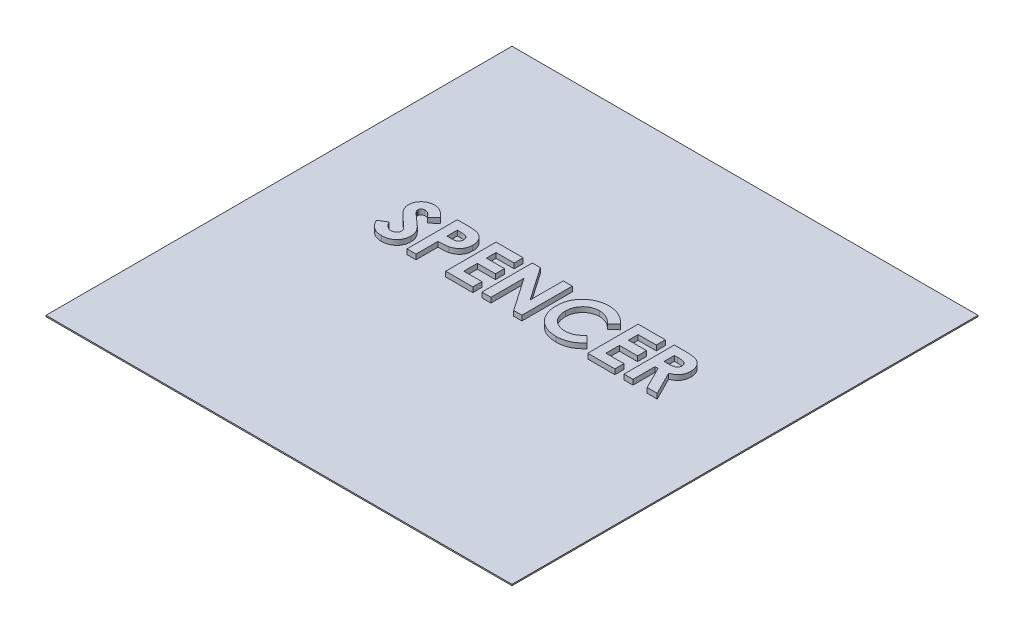
from build123d import *

# Parameters (mm, degrees)
SKETCH1_W           = 1850
SKETCH1_H           = 1850
BOSS_EXTRUDE1_DEPTH = 5
BOSS_EXTRUDE2_DEPTH = 20


with BuildPart() as part:
    # Sketch1 → Boss-Extrude1 (new body)
    with BuildSketch(Plane(origin=(0, 0, 0), x_dir=(1, 0, 0), z_dir=(0, 1, 0))):
        Rectangle(SKETCH1_W, SKETCH1_H)
    extrude(amount=BOSS_EXTRUDE1_DEPTH)

    # Sketch2 → Boss-Extrude2 (add)
    # profile 1 of 7: a face of its own
    with BuildSketch(Plane(origin=(0, 5, 0), x_dir=(1, 0, 0), z_dir=(0, 1, 0))):
        with BuildLine():
            Line((-458.08120012, 173.27724359), (-484.924148838, 148.717948718))
            add(Edge.make_bspline(
                [(-484.924148838, 148.717948718), (-486.073985661, 150.339913095), (-488.281512012, 153.453858509), (-491.859681973, 157.623504813), (-495.421694663, 161.180523411), (-499.000549963, 164.110054723), (-502.627969484, 166.394299668), (-506.297656556, 168.011570322), (-509.988806697, 169.039684625), (-512.468689809, 169.167709592), (-513.690174479, 169.230769231)],
                knots=[0, 0, 0, 0, 1.299362458, 2.494594718, 3.587462134, 4.587049575, 5.512617175, 6.380583204, 7.202344345, 8, 8, 8, 8], degree=3))
            add(Edge.make_bspline(
                [(-513.690174479, 169.230769231), (-514.829540341, 169.190811751), (-517.029356474, 169.113664355), (-520.165357571, 168.346824988), (-522.949544007, 167.023372855), (-525.379198537, 165.292847852), (-527.303843392, 163.207966424), (-528.840523056, 161.021461874), (-529.705802833, 158.608055341), (-529.819690676, 156.950430379), (-529.876071915, 156.129807692)],
                knots=[0, 0, 0, 0, 1.185010067, 2.2879431, 3.333075148, 4.379039566, 5.372662701, 6.27520591, 7.14612461, 8, 8, 8, 8], degree=3))
            add(Edge.make_bspline(
                [(-529.876071915, 156.129807692), (-529.840740651, 155.297351261), (-529.769588395, 153.620899694), (-529.08235446, 151.163851138), (-528.04649669, 148.763028677), (-527.0566923, 147.301533804), (-526.550751402, 146.554487179)],
                knots=[0, 0, 0, 0, 0.967525499, 1.948461899, 2.951351359, 4, 4, 4, 4], degree=3))
            add(Edge.make_bspline(
                [(-526.550751402, 146.554487179), (-526.090796395, 145.973815655), (-525.032040715, 144.637186494), (-523.013210479, 142.520174257), (-520.47798369, 139.926648962), (-517.328799488, 136.945794342), (-513.696389165, 133.470407209), (-509.412385814, 129.637106354), (-504.600101734, 125.327178903), (-501.179641701, 122.325901497), (-499.387289863, 120.753205128)],
                knots=[0, 0, 0, 0, 0.473873513, 1.090794244, 1.870441696, 2.795289791, 3.865433203, 5.087734844, 6.473946851, 8, 8, 8, 8], degree=3))
            add(Edge.make_bspline(
                [(-499.387289863, 120.753205128), (-497.704909837, 119.297190075), (-494.512102072, 116.533976002), (-489.969370658, 112.612037286), (-485.977066328, 109.083564652), (-482.477030321, 106.001512926), (-479.522319767, 103.333544327), (-477.100513054, 101.066905997), (-475.182031918, 99.245725216), (-474.091487722, 98.145730916), (-473.626071915, 97.676282051)],
                knots=[0, 0, 0, 0, 1.543621617, 2.929473131, 4.163658386, 5.240097082, 6.164993805, 6.925417477, 7.541396219, 8, 8, 8, 8], degree=3))
            add(Edge.make_bspline(
                [(-473.626071915, 97.676282051), (-471.860381373, 95.76542673), (-468.466104069, 92.09209174), (-464.054740136, 86.399577746), (-460.424044925, 80.84252336), (-457.615270261, 75.316363591), (-455.493970665, 69.741366951), (-453.998426349, 63.98080695), (-453.102734907, 57.974489348), (-453.003292245, 53.875910813), (-452.952994991, 51.802884615)],
                knots=[0, 0, 0, 0, 1.206664779, 2.319633467, 3.337109185, 4.282041471, 5.190008762, 6.099243693, 7.03861361, 8, 8, 8, 8], degree=3))
            add(Edge.make_bspline(
                [(-452.952994991, 51.802884615), (-452.988795289, 49.78297482), (-453.059036805, 45.819836622), (-453.919360671, 40.020374202), (-455.146132009, 34.470036966), (-457.04293571, 29.22922043), (-459.354748828, 24.211898188), (-462.252940463, 19.496224166), (-465.656469138, 15.034473817), (-469.557435586, 10.906406384), (-473.872367697, 7.160471314), (-478.500542469, 3.825751438), (-483.487216525, 1.072515416), (-488.789784509, -1.194578063), (-494.405408075, -2.940723774), (-500.327397323, -4.231288194), (-506.56481034, -5.005864615), (-510.830043243, -5.08683739), (-513.009084735, -5.128205128)],
                knots=[0, 0, 0, 0, 1.043214005, 2.046824704, 3.02475056, 3.976699089, 4.921714032, 5.875962561, 6.831408892, 7.817874052, 8.806269674, 9.781291748, 10.760897367, 11.74438705, 12.757449933, 13.795994037, 14.874007457, 16, 16, 16, 16], degree=3))
            add(Edge.make_bspline(
                [(-513.009084735, -5.128205128), (-514.71961375, -5.097859204), (-518.10744219, -5.037756871), (-523.100589131, -4.547071344), (-527.922036947, -3.755157112), (-532.566354707, -2.620107453), (-537.054465883, -1.181845589), (-541.386554795, 0.57493618), (-545.532715597, 2.677467314), (-549.524320104, 5.082511415), (-553.341964195, 7.875084416), (-557.033920477, 10.998093079), (-560.563516935, 14.499570673), (-563.947705504, 18.371236338), (-567.164833203, 22.624053702), (-570.320208166, 27.198794414), (-573.273596034, 32.180359449), (-575.098035095, 35.674967619), (-576.029918068, 37.459935897)],
                knots=[0, 0, 0, 0, 1.016823716, 2.013894106, 2.979844003, 3.91962641, 4.853723003, 5.779685073, 6.695824784, 7.614987388, 8.547259901, 9.504950863, 10.487499108, 11.500346958, 12.559593716, 13.656357062, 14.802919212, 16, 16, 16, 16], degree=3))
            Line((-576.029918068, 37.459935897), (-544.459405248, 56.41025641))
            add(Edge.make_bspline(
                [(-544.459405248, 56.41025641), (-543.293758926, 54.384084193), (-541.059115304, 50.499738885), (-537.272302776, 45.280628655), (-533.392906664, 40.811324663), (-529.331238805, 37.170822146), (-525.136687561, 34.310442904), (-520.788992274, 32.266217457), (-516.285098338, 31.000844219), (-513.217250398, 30.84631292), (-511.68696935, 30.769230769)],
                knots=[0, 0, 0, 0, 1.283663364, 2.460892379, 3.537111102, 4.529833553, 5.449777664, 6.316464042, 7.160231139, 8, 8, 8, 8], degree=3))
            add(Edge.make_bspline(
                [(-511.68696935, 30.769230769), (-510.130454439, 30.832180233), (-507.110588819, 30.954311361), (-502.800117082, 32.082399769), (-498.848113382, 33.853581326), (-495.432030572, 36.380813167), (-492.539507031, 39.297622822), (-490.404658627, 42.542706932), (-489.06353246, 46.053809605), (-488.921742909, 48.492852478), (-488.850430889, 49.719551282)],
                knots=[0, 0, 0, 0, 1.13588714, 2.203786484, 3.234766741, 4.283437687, 5.291419208, 6.222934724, 7.106237994, 8, 8, 8, 8], degree=3))
            add(Edge.make_bspline(
                [(-488.850430889, 49.719551282), (-488.91628462, 50.860794899), (-489.05006017, 53.179122052), (-490.035409647, 56.626101737), (-491.575811424, 60.071513806), (-493.398215352, 62.897534), (-495.252739544, 65.263684101), (-497.02608296, 67.31384613), (-499.185546136, 69.578916254), (-501.725653624, 72.061743761), (-504.612843977, 74.784185609), (-507.849549278, 77.745975205), (-511.472833229, 80.921022727), (-514.033777474, 83.083833729), (-515.372866786, 84.21474359)],
                knots=[0, 0, 0, 0, 0.916159276, 1.861089862, 2.860218735, 3.940849679, 4.552606315, 5.27541173, 6.11797699, 7.06649574, 8.129236253, 9.306560635, 10.591630461, 12, 12, 12, 12], degree=3))
            add(Edge.make_bspline(
                [(-515.372866786, 84.21474359), (-517.918528866, 86.368617819), (-522.804424913, 90.502554393), (-529.708815909, 96.608248576), (-535.930290407, 102.314579249), (-541.415113073, 107.692089134), (-546.233169031, 112.641468086), (-550.351828313, 117.202916853), (-553.725845574, 121.411620774), (-557.276271212, 126.396548928), (-560.649885428, 132.471026406), (-563.565645462, 139.779327002), (-565.457267506, 147.086700283), (-565.669197447, 151.99246822), (-565.773507812, 154.407051282)],
                knots=[0, 0, 0, 0, 1.345494975, 2.582412109, 3.71882943, 4.751509156, 5.681369928, 6.505683931, 7.230279997, 7.856715994, 8.973648664, 10.023341002, 11.027102913, 12, 12, 12, 12], degree=3))
            add(Edge.make_bspline(
                [(-565.773507812, 154.407051282), (-565.73012527, 156.119343989), (-565.644657002, 159.492744556), (-564.882266869, 164.452838569), (-563.74284577, 169.238912529), (-562.088079216, 173.833504656), (-559.940392033, 178.230860039), (-557.332109373, 182.452505583), (-554.222729549, 186.459586217), (-550.718668401, 190.249445528), (-546.858090154, 193.712945655), (-542.732571689, 196.76983156), (-538.365463805, 199.351721845), (-533.783482255, 201.493587314), (-528.958234408, 203.133049268), (-523.925267642, 204.295181619), (-518.677363087, 204.986380881), (-515.107851687, 205.0803414), (-513.289533453, 205.128205128)],
                knots=[0, 0, 0, 0, 1.010766082, 1.991317756, 2.957454644, 3.913069143, 4.869106762, 5.843196583, 6.838735724, 7.860187025, 8.887984031, 9.89767229, 10.887916223, 11.879572884, 12.879850636, 13.892031539, 14.926195476, 16, 16, 16, 16], degree=3))
            add(Edge.make_bspline(
                [(-513.289533453, 205.128205128), (-510.933083018, 205.042001151), (-506.238783142, 204.87027366), (-499.298125384, 203.527420797), (-492.518781071, 201.415643221), (-487.055858372, 198.868015912), (-482.709112752, 196.400128132), (-479.377738276, 194.128007938), (-475.987885431, 191.525172136), (-472.512217156, 188.583418506), (-469.01531675, 185.247320544), (-465.397750611, 181.59629669), (-461.7088125, 177.598793558), (-459.311587622, 174.742995857), (-458.08120012, 173.27724359)],
                knots=[0, 0, 0, 0, 1.282922637, 2.555718331, 3.837320111, 5.142675274, 5.830281639, 6.55870424, 7.337177975, 8.157850921, 9.037902056, 9.96903443, 10.957596896, 12, 12, 12, 12], degree=3))
        make_face()
    # profile 2 of 7: a face of its own
    with BuildSketch(Plane(origin=(0, 5, 0), x_dir=(1, 0, 0), z_dir=(0, 1, 0))):
        with BuildLine():
            Line((-417.055559094, 200), (-376.99145653, 200))
            add(Edge.make_bspline(
                [(-376.99145653, 200), (-374.373720043, 199.988282454), (-369.323557648, 199.965676853), (-362.040807979, 199.691553861), (-355.322114828, 199.200308763), (-349.169021801, 198.59320751), (-343.5840589, 197.742075175), (-338.560232073, 196.766318594), (-334.096498758, 195.577563089), (-330.142523726, 194.166526781), (-326.593958853, 192.502970103), (-323.235871964, 190.731163494), (-320.144156196, 188.616574798), (-317.162763313, 186.387105402), (-314.462144688, 183.829774952), (-311.873819564, 181.114777501), (-309.507410569, 178.134438483), (-307.351952643, 174.924834098), (-305.396620174, 171.545264113), (-303.688310921, 167.989686858), (-302.302626121, 164.252476004), (-301.140208876, 160.357807057), (-300.206544021, 156.305849754), (-299.585066971, 152.071684198), (-299.162928494, 147.684874942), (-299.125680602, 144.699209795), (-299.106841145, 143.189102564)],
                knots=[0, 0, 0, 0, 1.698747864, 3.27724071, 4.728299578, 6.070144658, 7.288476769, 8.393259625, 9.389771311, 10.283485332, 11.113357557, 11.931608583, 12.74405601, 13.541433047, 14.344816069, 15.154114104, 15.974336324, 16.810834471, 17.661136416, 18.50621059, 19.367396281, 20.244825668, 21.142564693, 22.063065223, 23.020325768, 24, 24, 24, 24], degree=3))
            add(Edge.make_bspline(
                [(-299.106841145, 143.189102564), (-299.134099481, 141.518506891), (-299.18766546, 138.235581102), (-299.712784678, 133.423214664), (-300.609854212, 128.835058971), (-301.782277171, 124.432421284), (-303.417137608, 120.287734752), (-305.284888887, 116.302105883), (-307.582815392, 112.587279476), (-310.208563783, 109.096787528), (-313.076180583, 105.80225069), (-316.253742893, 102.798792484), (-319.680685007, 100.065938439), (-323.337169585, 97.575048032), (-327.236924169, 95.331145942), (-331.377134893, 93.313220411), (-335.786073462, 91.585810955), (-338.85632563, 90.682389797), (-340.412930889, 90.224358974)],
                knots=[0, 0, 0, 0, 1.102006807, 2.165578795, 3.188629044, 4.184801286, 5.166646146, 6.124351954, 7.085497154, 8.042432466, 9.003981491, 9.963833307, 10.922997304, 11.89326795, 12.880200226, 13.889073926, 14.929769137, 16, 16, 16, 16], degree=3))
            add(Edge.make_bspline(
                [(-340.412930889, 90.224358974), (-341.438200655, 89.969270197), (-343.659265125, 89.416665762), (-347.334516775, 88.855633561), (-351.569858419, 88.339798949), (-356.378985686, 87.896501546), (-361.764671153, 87.595162606), (-367.721700068, 87.359830296), (-374.252772063, 87.188719403), (-378.794221263, 87.182647637), (-381.158123197, 87.179487179)],
                knots=[0, 0, 0, 0, 0.618981996, 1.340914327, 2.176866532, 3.120127938, 4.170906482, 5.338178032, 6.614476169, 8, 8, 8, 8], degree=3))
            Line((-381.158123197, 87.179487179), (-381.158123197, 0))
            Line((-381.158123197, 0), (-417.055559094, 0))
            Line((-417.055559094, 0), (-417.055559094, 200))
        make_face()
        with BuildLine():
            Line((-381.158123197, 123.076923077), (-368.457802684, 123.076923077))
            add(Edge.make_bspline(
                [(-368.457802684, 123.076923077), (-366.146778857, 123.091576762), (-361.894460684, 123.118539759), (-356.08729569, 123.50844038), (-351.420546197, 124.103897383), (-347.733727437, 124.957920433), (-344.822634822, 126.254013499), (-342.311999697, 127.753349106), (-340.158563854, 129.649217824), (-338.294005368, 131.815572225), (-336.80334705, 134.304822012), (-335.769653148, 137.076434584), (-335.098185913, 140.072175392), (-335.036169677, 142.157012712), (-335.004277043, 143.229166667)],
                knots=[0, 0, 0, 0, 1.8619151, 3.425951444, 4.686033666, 5.651700536, 6.461346321, 7.243864085, 7.999046032, 8.762387399, 9.539336099, 10.322741239, 11.137448474, 12, 12, 12, 12], degree=3))
            add(Edge.make_bspline(
                [(-335.004277043, 143.229166667), (-335.035841617, 144.165893613), (-335.097084479, 145.983369111), (-335.546991225, 148.606437059), (-336.264013158, 151.051677501), (-337.302950375, 153.293553138), (-338.646050189, 155.328254665), (-340.28356066, 157.154980543), (-342.194469313, 158.81285165), (-343.669802517, 159.69038815), (-344.419341145, 160.136217949)],
                knots=[0, 0, 0, 0, 1.102301479, 2.1387299, 3.123554645, 4.094223062, 5.036071848, 5.982632524, 6.975082478, 8, 8, 8, 8], degree=3))
            add(Edge.make_bspline(
                [(-344.419341145, 160.136217949), (-345.05424363, 160.457306341), (-346.398462296, 161.137116267), (-348.68779701, 161.92744501), (-351.329654309, 162.594174367), (-354.34186971, 163.147553297), (-357.712426618, 163.577032816), (-361.440723672, 163.905477208), (-365.53224741, 164.037557491), (-368.377657355, 164.080297569), (-369.860046274, 164.102564103)],
                knots=[0, 0, 0, 0, 0.656809284, 1.390599849, 2.23162475, 3.173112763, 4.218524733, 5.370385145, 6.63003504, 8, 8, 8, 8], degree=3))
            Line((-369.860046274, 164.102564103), (-381.158123197, 164.102564103))
            Line((-381.158123197, 164.102564103), (-381.158123197, 123.076923077))
        make_face(mode=Mode.SUBTRACT)
    # profile 3 of 7: a face of its own
    with BuildSketch(Plane(origin=(0, 5, 0), x_dir=(1, 0, 0), z_dir=(0, 1, 0))):
        Polygon((-263.209405248, 200), (-155.517097556, 200), (-155.517097556, 164.102564103), (-227.31196935, 164.102564103), (-227.31196935, 125.641025641), (-155.517097556, 125.641025641), (-155.517097556, 89.743589744), (-227.31196935, 89.743589744), (-227.31196935, 35.897435897), (-155.517097556, 35.897435897), (-155.517097556, 0), (-263.209405248, 0), align=None)
    # profile 4 of 7: a face of its own
    with BuildSketch(Plane(origin=(0, 5, 0), x_dir=(1, 0, 0), z_dir=(0, 1, 0))):
        Polygon((-119.619661658, 200), (-87.287930889, 200), (3.457261419, 68.389423077), (3.457261419, 200), (39.354697316, 200), (39.354697316, 0), (6.782581932, 0), (-83.722225761, 131.209935897), (-83.722225761, 0), (-119.619661658, 0), align=None)
    # profile 5 of 7: a face of its own
    with BuildSketch(Plane(origin=(0, 5, 0), x_dir=(1, 0, 0), z_dir=(0, 1, 0))):
        with BuildLine():
            Line((264.995722957, 165.304487179), (238.673607573, 140.144230769))
            add(Edge.make_bspline(
                [(238.673607573, 140.144230769), (236.440751304, 142.453007893), (232.079283482, 146.962772931), (225.051317484, 152.933304411), (217.742488737, 157.908934556), (210.294975916, 162.099378586), (202.574819855, 165.269748147), (194.67128658, 167.580049848), (186.533909707, 168.988553473), (181.026846027, 169.149711215), (178.256940906, 169.230769231)],
                knots=[0, 0, 0, 0, 1.115251505, 2.178435587, 3.19620269, 4.182487026, 5.141301733, 6.088180966, 7.038406374, 8, 8, 8, 8], degree=3))
            add(Edge.make_bspline(
                [(178.256940906, 169.230769231), (175.943733522, 169.166730565), (171.378873612, 169.040357313), (164.676463043, 168.113916732), (158.265260946, 166.538464207), (152.123320761, 164.367198793), (146.26871541, 161.557696588), (140.689169986, 158.112132074), (135.398440626, 154.061623599), (130.4664148, 149.427128679), (125.954770904, 144.363594712), (121.96844625, 138.960816048), (118.629259908, 133.231170151), (115.888843992, 127.232682663), (113.754165929, 120.937589616), (112.229737595, 114.350129115), (111.348048986, 107.462456003), (111.216451052, 102.780267144), (111.149569111, 100.400641026)],
                knots=[0, 0, 0, 0, 1.035432265, 2.043311493, 3.022114605, 3.98653278, 4.95457646, 5.923598177, 6.917315552, 7.932509744, 8.948865224, 9.949768934, 10.933144597, 11.912367597, 12.897413939, 13.903909035, 14.934704909, 16, 16, 16, 16], degree=3))
            add(Edge.make_bspline(
                [(111.149569111, 100.400641026), (111.168843724, 98.730452919), (111.206834381, 95.438477845), (111.622709314, 90.568733056), (112.292366018, 85.843929348), (113.261525181, 81.271223541), (114.473468241, 76.846652885), (115.895353409, 72.532046837), (117.679087435, 68.387023535), (119.659059118, 64.363441226), (121.961743368, 60.571088388), (124.444461779, 56.95476522), (127.13656455, 53.532198578), (130.055488589, 50.317380017), (133.242314121, 47.360549954), (136.614673497, 44.572792989), (140.229453752, 42.023896121), (144.011566741, 39.649891979), (147.99368514, 37.587574382), (152.067764843, 35.719513066), (156.295577111, 34.202369536), (160.62564579, 32.979413444), (165.042496741, 31.939471935), (169.589330868, 31.299147988), (174.226732813, 30.814238157), (177.360838143, 30.78429781), (178.93803065, 30.769230769)],
                knots=[0, 0, 0, 0, 1.103660481, 2.175337485, 3.227646561, 4.255952547, 5.262355991, 6.258840057, 7.255597736, 8.242457506, 9.22035537, 10.185017736, 11.140346927, 12.096287581, 13.051739095, 14.01125915, 14.986044842, 15.97314143, 16.960198552, 17.947847494, 18.933482797, 19.925264591, 20.920966487, 21.929612487, 22.958107872, 24, 24, 24, 24], degree=3))
            add(Edge.make_bspline(
                [(178.93803065, 30.769230769), (181.613220189, 30.846611447), (186.869271979, 30.998644357), (194.583283734, 32.187520187), (201.933968433, 34.143153648), (207.807130332, 36.452643133), (212.408597547, 38.733293981), (215.911626515, 40.842783705), (219.534031492, 43.202479571), (223.21564743, 45.901439056), (226.997885206, 48.907273563), (230.813979601, 52.285816477), (234.761623309, 55.925817227), (237.347685571, 58.523757271), (238.673607573, 59.855769231)],
                knots=[0, 0, 0, 0, 1.404581149, 2.759636711, 4.088442092, 5.392261763, 6.066678138, 6.783632037, 7.538459478, 8.336747902, 9.180226004, 10.074962426, 11.012997595, 12, 12, 12, 12], degree=3))
            Line((238.673607573, 59.855769231), (264.194440906, 33.052884615))
            add(Edge.make_bspline(
                [(264.194440906, 33.052884615), (262.40046369, 31.320855935), (258.89900382, 27.940306356), (253.617148809, 23.140241408), (248.341941223, 18.82684945), (243.200819085, 14.843573258), (238.109565454, 11.306455342), (233.068720248, 8.211963141), (228.13534804, 5.481832471), (223.207005773, 3.162105646), (218.25302676, 1.192416645), (213.155964527, -0.503356301), (207.900236875, -1.937919208), (202.453744219, -3.09542307), (196.867288122, -4.023584904), (191.088586779, -4.650088774), (185.15428001, -5.071266481), (181.128947791, -5.109112789), (179.09828706, -5.128205128)],
                knots=[0, 0, 0, 0, 1.244526981, 2.429050516, 3.560637417, 4.644440555, 5.67424972, 6.652764056, 7.595344123, 8.486817594, 9.369275933, 10.254498637, 11.166417451, 12.086725134, 13.032340136, 13.991389299, 14.986715468, 16, 16, 16, 16], degree=3))
            add(Edge.make_bspline(
                [(179.09828706, -5.128205128), (175.368214834, -5.033118148), (168.069500326, -4.84705936), (157.373424517, -3.46848971), (147.212439617, -1.157341978), (137.561825853, 2.111258382), (128.424651894, 6.286742155), (119.803255309, 11.405689196), (111.711531872, 17.45449927), (104.214846781, 24.362274451), (97.433738335, 31.991332234), (91.44002376, 40.182847335), (86.482022837, 48.977078049), (82.365287838, 58.244105497), (79.146055211, 68.026218723), (76.880261191, 78.333998995), (75.482962555, 89.157493514), (75.330096098, 96.550189771), (75.252133214, 100.320512821)],
                knots=[0, 0, 0, 0, 1.078019885, 2.10938526, 3.111377082, 4.085535484, 5.04941344, 6.010039228, 6.978205633, 7.964457913, 8.951525778, 9.924444315, 10.892603023, 11.863865945, 12.85144698, 13.863884204, 14.910567087, 16, 16, 16, 16], degree=3))
            add(Edge.make_bspline(
                [(75.252133214, 100.320512821), (75.28507655, 102.779485345), (75.350362191, 107.652567897), (76.036520327, 114.8310133), (76.993064666, 121.828713539), (78.51053528, 128.5730093), (80.33969644, 135.154758683), (82.614498667, 141.502425761), (85.331308787, 147.634254366), (88.402557613, 153.56050955), (91.877030682, 159.24236799), (95.758398526, 164.631013568), (99.946739601, 169.768045636), (104.54269292, 174.585311927), (109.479473261, 179.125108976), (114.779369619, 183.362834753), (120.410505766, 187.359263026), (126.388123094, 191.01133561), (132.596092426, 194.314829377), (138.956114932, 197.228651969), (145.452564773, 199.663936651), (152.057974373, 201.683915463), (158.800251501, 203.191686816), (165.631271499, 204.33302109), (172.609158145, 204.971034246), (177.294204516, 205.075481071), (179.659184496, 205.128205128)],
                knots=[0, 0, 0, 0, 1.071919942, 2.124283339, 3.142214191, 4.149696895, 5.136002878, 6.119640489, 7.086990633, 8.058538607, 9.028339693, 9.988281803, 10.952401235, 11.916291999, 12.888973767, 13.874849856, 14.873389453, 15.898127285, 16.927174885, 17.938320013, 18.946391617, 19.950418109, 20.947802303, 21.956882652, 22.968648068, 24, 24, 24, 24], degree=3))
            add(Edge.make_bspline(
                [(179.659184496, 205.128205128), (181.676754909, 205.097982383), (185.69091862, 205.037851126), (191.66868199, 204.53659167), (197.598638007, 203.749368764), (203.459555609, 202.561617046), (209.293358071, 201.15160566), (215.02338269, 199.305390245), (220.740023703, 197.247435243), (226.353624086, 194.787570248), (231.872019603, 192.10240541), (237.165933145, 189.055988387), (242.324249033, 185.835792281), (247.232662083, 182.251231776), (251.983117441, 178.432325548), (256.55077456, 174.361256255), (260.895549579, 169.970147219), (263.622089139, 166.867569475), (264.995722957, 165.304487179)],
                knots=[0, 0, 0, 0, 0.996412454, 1.982464992, 2.961075852, 3.949442424, 4.934965278, 5.923860011, 6.921385422, 7.934793307, 8.949617135, 9.951082467, 10.950285876, 11.951772932, 12.951063433, 13.960125323, 14.972308753, 16, 16, 16, 16], degree=3))
        make_face()
    # profile 6 of 7: a face of its own
    with BuildSketch(Plane(origin=(0, 5, 0), x_dir=(1, 0, 0), z_dir=(0, 1, 0))):
        Polygon((300.893158855, 200), (408.585466547, 200), (408.585466547, 164.102564103), (336.790594752, 164.102564103), (336.790594752, 125.641025641), (408.585466547, 125.641025641), (408.585466547, 89.743589744), (336.790594752, 89.743589744), (336.790594752, 35.897435897), (408.585466547, 35.897435897), (408.585466547, 0), (300.893158855, 0), align=None)
    # profile 7 of 7: a face of its own
    with BuildSketch(Plane(origin=(0, 5, 0), x_dir=(1, 0, 0), z_dir=(0, 1, 0))):
        with BuildLine():
            Line((444.482902444, 200), (486.309825521, 200))
            add(Edge.make_bspline(
                [(486.309825521, 200), (489.074572405, 199.990186735), (494.39195945, 199.971313063), (502.059341138, 199.673536508), (509.102885655, 199.259155992), (515.533021606, 198.626800325), (521.346998074, 197.788373148), (526.550642021, 196.800006248), (531.14380135, 195.673550265), (535.165213017, 194.269897236), (538.794338191, 192.6865979), (542.177187399, 190.867357931), (545.388391324, 188.83243514), (548.406486536, 186.528285202), (551.257700992, 183.996359205), (553.947413679, 181.234108519), (556.437616464, 178.218110394), (558.71288991, 174.967422111), (560.786618509, 171.547772581), (562.619359654, 167.954466602), (564.1097478, 164.185005268), (565.426665493, 160.293865446), (566.375198643, 156.225422529), (567.034889574, 152.019283495), (567.517889466, 147.660642287), (567.54565965, 144.699574973), (567.559825521, 143.189102564)],
                knots=[0, 0, 0, 0, 1.749336639, 3.364467119, 4.854658419, 6.213483162, 7.451590619, 8.570285859, 9.5643256, 10.440900261, 11.26203566, 12.067320669, 12.869050712, 13.665104639, 14.467235401, 15.27997916, 16.102287765, 16.939272006, 17.78853747, 18.631303466, 19.488103222, 20.351255419, 21.228522269, 22.127379805, 23.044756219, 24, 24, 24, 24], degree=3))
            add(Edge.make_bspline(
                [(567.559825521, 143.189102564), (567.523027683, 141.612516359), (567.450873828, 138.521118158), (567.062213911, 133.980106333), (566.351865674, 129.635583849), (565.275939927, 125.500270933), (564.039303031, 121.522698796), (562.394893175, 117.776256129), (560.539014125, 114.206456353), (558.3348408, 110.863795638), (555.915868257, 107.674026811), (553.102654073, 104.759361749), (550.077451317, 101.963148242), (546.670202323, 99.460531617), (543.031101792, 97.082293981), (539.087844625, 94.926977334), (534.866165871, 92.940401978), (531.898116637, 91.832550333), (530.380338342, 91.266025641)],
                knots=[0, 0, 0, 0, 1.099860209, 2.156625411, 3.176576793, 4.16617041, 5.135385252, 6.078461593, 7.016046972, 7.938469504, 8.868247731, 9.803980173, 10.76021508, 11.73834243, 12.748633912, 13.790971185, 14.870363756, 16, 16, 16, 16], degree=3))
            Line((530.380338342, 91.266025641), (576.534184496, 0))
            Line((576.534184496, 0), (536.630338342, 0))
            Line((536.630338342, 0), (492.559825521, 87.179487179))
            Line((492.559825521, 87.179487179), (480.380338342, 87.179487179))
            Line((480.380338342, 87.179487179), (480.380338342, 0))
            Line((480.380338342, 0), (444.482902444, 0))
            Line((444.482902444, 0), (444.482902444, 200))
        make_face()
        with BuildLine():
            Line((480.380338342, 123.076923077), (494.362710137, 123.076923077))
            add(Edge.make_bspline(
                [(494.362710137, 123.076923077), (496.072171317, 123.096176178), (499.34542216, 123.133041729), (504.052786786, 123.304039435), (508.328196512, 123.716059411), (512.190011392, 124.236631253), (515.657663727, 124.837706621), (518.700223281, 125.699084119), (521.364571254, 126.622071912), (523.619135021, 127.769106314), (525.5453825, 129.073533211), (527.208573909, 130.555394592), (528.584271677, 132.270460452), (529.716541111, 134.172122698), (530.597323628, 136.277201065), (531.24022739, 138.562586563), (531.599515521, 141.054312672), (531.640852844, 142.773942968), (531.662389624, 143.669871795)],
                knots=[0, 0, 0, 0, 1.688639943, 3.233382647, 4.650958383, 5.928841754, 7.082724185, 8.122798841, 9.049171256, 9.863274652, 10.613301712, 11.341792392, 12.054588806, 12.776240173, 13.521029143, 14.301969904, 15.115324896, 16, 16, 16, 16], degree=3))
            add(Edge.make_bspline(
                [(531.662389624, 143.669871795), (531.621672368, 144.729821003), (531.541690864, 146.811894801), (530.748025867, 149.809351007), (529.484682627, 152.583701806), (527.752985069, 155.122411995), (525.572137129, 157.348020599), (523.069442054, 159.309912308), (520.190885645, 160.861229475), (517.525559024, 161.88446176), (515.100734797, 162.496672192), (512.912407434, 162.952885992), (510.378311172, 163.276217806), (507.496532908, 163.619168749), (504.274418391, 163.841555076), (500.694405171, 164.003852768), (496.76677502, 164.070256726), (494.028843773, 164.091484902), (492.599889624, 164.102564103)],
                knots=[0, 0, 0, 0, 1.020303359, 2.004196876, 2.966617323, 3.9489082, 4.950758222, 5.960522915, 7.003732012, 8.091992268, 8.70421221, 9.413913587, 10.24622431, 11.166358409, 12.212345909, 13.359657661, 14.621978493, 16, 16, 16, 16], degree=3))
            Line((492.599889624, 164.102564103), (480.380338342, 164.102564103))
            Line((480.380338342, 164.102564103), (480.380338342, 123.076923077))
        make_face(mode=Mode.SUBTRACT)
    extrude(amount=BOSS_EXTRUDE2_DEPTH)


solid = part.part
